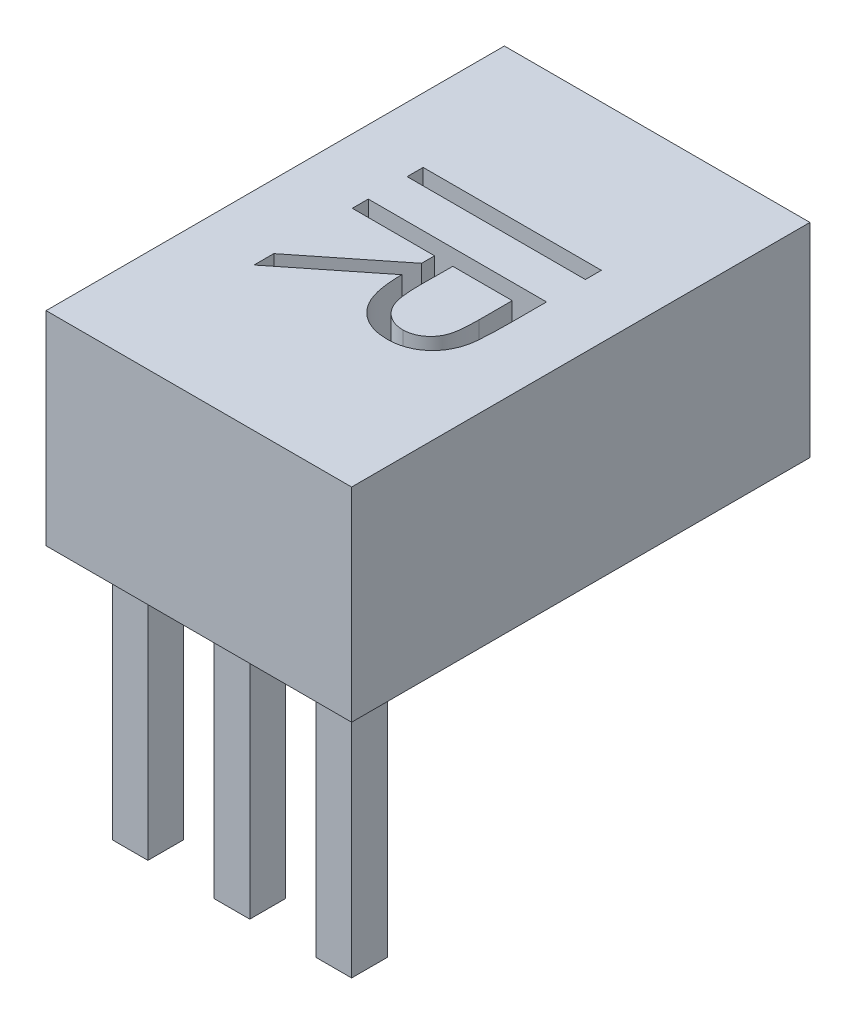
from build123d import *

# Parameters (mm, degrees)
SKETCH1_W           = 6
SKETCH1_H           = 9
BOSS_EXTRUDE1_DEPTH = 4
SKETCH2_W           = 0.7
SKETCH2_H           = 0.7
BOSS_EXTRUDE2_DEPTH = 5
SKETCH3_W           = 3.5
SKETCH3_H           = 0.314102564
CUT_EXTRUDE1_DEPTH  = 1


with BuildPart() as part:
    # Sketch1 → Boss-Extrude1 (new body)
    with BuildSketch(Plane(origin=(0, 0, 0), x_dir=(1, 0, 0), z_dir=(0, 1, 0))):
        Rectangle(SKETCH1_W, SKETCH1_H)
    extrude(amount=BOSS_EXTRUDE1_DEPTH)

    # Sketch2 → Boss-Extrude2 (add)
    with BuildSketch(Plane.XZ):
        with Locations((-2, 3.5)):
            Rectangle(SKETCH2_W, SKETCH2_H)
        with Locations((0, 3.5)):
            Rectangle(SKETCH2_W, SKETCH2_H)
        with Locations((2, 3.5)):
            Rectangle(SKETCH2_W, SKETCH2_H)
    extrude(amount=BOSS_EXTRUDE2_DEPTH)

    # Sketch3 → Cut-Extrude1 (cut)
    # profile 1 of 2: a face of its own
    with BuildSketch(Plane(origin=(0, 4, 0), x_dir=(1, 0, 0), z_dir=(0, 1, 0))):
        with Locations((0.016516605, 1.480769231)):
            Rectangle(SKETCH3_W, SKETCH3_H)
    # profile 2 of 2: a face of its own
    with BuildSketch(Plane(origin=(0, 4, 0), x_dir=(1, 0, 0), z_dir=(0, 1, 0))):
        with BuildLine():
            Line((1.766516605, 0.560897436), (1.766516605, -0.139523237))
            add(Edge.make_bspline(
                [(1.766516605, -0.139523237), (1.766361019, -0.186264366), (1.766062277, -0.27601251), (1.764396514, -0.40458578), (1.759622158, -0.521412877), (1.755513575, -0.626432717), (1.748021633, -0.719643372), (1.740860986, -0.801330663), (1.731487326, -0.87111836), (1.722781903, -0.913364211), (1.718840323, -0.932491987)],
                knots=[0, 0, 0, 0, 1.410062039, 2.707475311, 3.878576406, 4.937260626, 5.877586885, 6.699081471, 7.410979367, 8, 8, 8, 8], degree=3))
            add(Edge.make_bspline(
                [(1.718840323, -0.932491987), (1.712514276, -0.958099062), (1.699997132, -1.008766944), (1.673527119, -1.081710467), (1.64294591, -1.151248932), (1.606748352, -1.217121383), (1.565565808, -1.27933393), (1.519157663, -1.337793424), (1.467287579, -1.392165635), (1.4112801, -1.442868932), (1.350646542, -1.488829838), (1.286270173, -1.528602989), (1.218553628, -1.562660539), (1.147261096, -1.589849705), (1.072995235, -1.611722556), (0.995107565, -1.627150208), (0.913946279, -1.636401005), (0.858588413, -1.637342914), (0.830519009, -1.637820513)],
                knots=[0, 0, 0, 0, 1.02737288, 2.032829108, 3.019628684, 3.985738875, 4.958353778, 5.924249254, 6.890702889, 7.883913451, 8.865824512, 9.85161466, 10.829249435, 11.81541824, 12.821369441, 13.843154991, 14.906364023, 16, 16, 16, 16], degree=3))
            add(Edge.make_bspline(
                [(0.830519009, -1.637820513), (0.783883851, -1.636351553), (0.692886578, -1.633485231), (0.560826446, -1.606759595), (0.437634391, -1.562985023), (0.323481852, -1.502654559), (0.220533831, -1.425861636), (0.130417059, -1.333574003), (0.05430934, -1.22626297), (0.002092736, -1.125894415), (-0.031505665, -1.037192031), (-0.055264297, -0.963952361), (-0.073311274, -0.883999597), (-0.089713454, -0.798480783), (-0.102229635, -0.706735362), (-0.111118503, -0.608948089), (-0.116834112, -0.50487439), (-0.117669187, -0.433534628), (-0.118098779, -0.396834936)],
                knots=[0, 0, 0, 0, 1.260402266, 2.459371274, 3.627181936, 4.786749125, 5.93865593, 7.087644312, 8.261344208, 9.485713728, 10.136162886, 10.825977872, 11.566646758, 12.35154167, 13.181268117, 14.0701832, 15.007234106, 16, 16, 16, 16], degree=3))
            Line((-0.118098779, -0.396834936), (-1.733483395, -1.682692308))
            Line((-1.733483395, -1.682692308), (-1.733483395, -1.294270833))
            Line((-1.733483395, -1.294270833), (-0.118098779, -0.008413462))
            Line((-0.118098779, -0.008413462), (-0.118098779, 0.246794872))
            Line((-0.118098779, 0.246794872), (-1.733483395, 0.246794872))
            Line((-1.733483395, 0.246794872), (-1.733483395, 0.560897436))
            Line((-1.733483395, 0.560897436), (1.766516605, 0.560897436))
        make_face()
        with BuildLine():
            Line((1.407542246, 0.246794872), (0.24087558, 0.246794872))
            Line((0.24087558, 0.246794872), (0.235967727, -0.394030449))
            add(Edge.make_bspline(
                [(0.235967727, -0.394030449), (0.23595449, -0.423950488), (0.235928834, -0.481944044), (0.239922609, -0.565844711), (0.244465932, -0.643964817), (0.251415263, -0.716005588), (0.260371383, -0.781999101), (0.271574209, -0.841912719), (0.284626785, -0.895843103), (0.304826248, -0.958744454), (0.336846887, -1.02896197), (0.383355041, -1.105368013), (0.442230666, -1.170213186), (0.508484032, -1.226122294), (0.582826418, -1.269186547), (0.661958048, -1.300529767), (0.745195752, -1.320199384), (0.802367596, -1.322537824), (0.831220131, -1.323717949)],
                knots=[0, 0, 0, 0, 1.14660753, 2.222451964, 3.218720504, 4.145691244, 4.995719623, 5.770487122, 6.480909919, 7.121111896, 8.299844659, 9.430703709, 10.534634535, 11.641396424, 12.741395289, 13.810956493, 14.895269934, 16, 16, 16, 16], degree=3))
            add(Edge.make_bspline(
                [(0.831220131, -1.323717949), (0.85937451, -1.322534196), (0.915166216, -1.320188431), (0.996619653, -1.300491656), (1.074046514, -1.268684245), (1.145970993, -1.224082893), (1.211802985, -1.170189), (1.267351902, -1.106181988), (1.313870883, -1.035285329), (1.343381026, -0.968975107), (1.361509576, -0.909746951), (1.37425074, -0.858314844), (1.384573588, -0.799980074), (1.392599408, -0.734882443), (1.399821729, -0.663139722), (1.40450449, -0.584555466), (1.407334752, -0.499220423), (1.407471472, -0.440073241), (1.407542246, -0.409455128)],
                knots=[0, 0, 0, 0, 1.100801541, 2.181386982, 3.260112282, 4.364594493, 5.481957178, 6.577424609, 7.668452592, 8.790448866, 9.403819393, 10.091598921, 10.863153553, 11.720938239, 12.658472417, 13.685008818, 14.801622349, 16, 16, 16, 16], degree=3))
            Line((1.407542246, -0.409455128), (1.407542246, 0.246794872))
        make_face(mode=Mode.SUBTRACT)
    extrude(amount=-CUT_EXTRUDE1_DEPTH, mode=Mode.SUBTRACT)


solid = part.part
